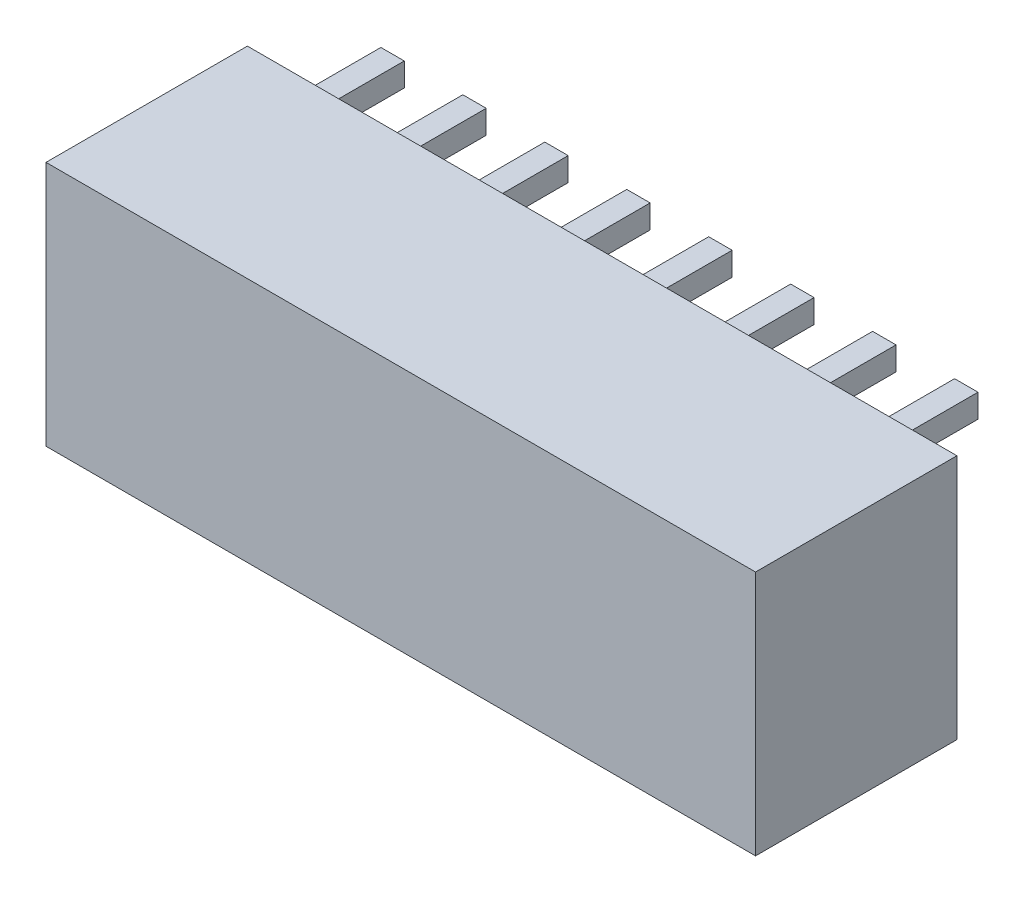
from build123d import *

# Parameters (mm, degrees)
SKETCH_1_W                         = 30.3
SKETCH_1_H                         = 10.5
EXTRUDE_1_DEPTH                    = 8.6
CUT_EXTRUDE_1_DEPTH                = 7
EXTRUDE_START                      = -5
SKETCH_3_W                         = 1
SKETCH_3_H                         = 1
EXTRUDE_2_DEPTH                    = 8.6
CHAMFER_1_SIZE                     = 0.3
PATTERN_LINEAR_1_COUNT             = 8
PATTERN_LINEAR_1_PITCH             = 3.5
CHAMFER_1_OF_PATTERN_LINEAR_1_SIZE = 0.3


with BuildPart() as part:
    # Эскиз1 → Бобышка-Вытянуть1 (new body)
    with BuildSketch(Plane.XY):
        Rectangle(SKETCH_1_W, SKETCH_1_H)
    extrude(amount=EXTRUDE_1_DEPTH)

    # Эскиз2 → Вырез-Вытянуть1 (cut)
    with BuildSketch(Plane.XZ.offset(5.25)):
        Polygon((-14.15, 6.6), (14.15, 6.6), (14.15, 0.2), (11.95, 0.2), (11.95, 1.8), (-10.35, 1.8), (-10.35, 0.2), (-12.55, 0.2), (-12.55, 1.8), (-14.15, 1.8), align=None)
    extrude(amount=-CUT_EXTRUDE_1_DEPTH, mode=Mode.SUBTRACT)

    # Эскиз3 → Бобышка-Вытянуть2 (add)
    with BuildSketch(Plane(origin=(0, 0, 0), x_dir=(-1, 0, 0), z_dir=(0, 0, -1)).offset(EXTRUDE_START)):
        with Locations((12.25, 4.25)):
            Rectangle(SKETCH_3_W, SKETCH_3_H)
    extrude_2 = extrude(amount=EXTRUDE_2_DEPTH)

    # Фаска1
    chamfer_1_edges = [part.edges().sort_by_distance(p)[0] for p in [
        (-11.75, 4.25, -3.6),
        (-12.25, 3.75, -3.6),
        (-12.75, 4.25, -3.6),
        (-12.25, 4.75, -3.6),
    ]]
    chamfer(chamfer_1_edges, length=CHAMFER_1_SIZE)

    # Линейный массив1: Бобышка-Вытянуть2 ×8
    with Locations(*[(i * PATTERN_LINEAR_1_PITCH, 0, 0) for i in range(1, PATTERN_LINEAR_1_COUNT)]):
        add(extrude_2)

    # Фаска1 of Линейный массив1
    chamfer_1_of_pattern_linear_1_edges = [part.edges().sort_by_distance(p)[0] for p in [
        (-8.25, 4.25, -3.6),
        (-8.75, 3.75, -3.6),
        (-9.25, 4.25, -3.6),
        (-8.75, 4.75, -3.6),
        (-4.75, 4.25, -3.6),
        (-5.25, 3.75, -3.6),
        (-5.75, 4.25, -3.6),
        (-5.25, 4.75, -3.6),
        (-1.25, 4.25, -3.6),
        (-1.75, 3.75, -3.6),
        (-2.25, 4.25, -3.6),
        (-1.75, 4.75, -3.6),
        (2.25, 4.25, -3.6),
        (1.75, 3.75, -3.6),
        (1.25, 4.25, -3.6),
        (1.75, 4.75, -3.6),
        (5.75, 4.25, -3.6),
        (5.25, 3.75, -3.6),
        (4.75, 4.25, -3.6),
        (5.25, 4.75, -3.6),
        (9.25, 4.25, -3.6),
        (8.75, 3.75, -3.6),
        (8.25, 4.25, -3.6),
        (8.75, 4.75, -3.6),
        (12.75, 4.25, -3.6),
        (12.25, 3.75, -3.6),
        (11.75, 4.25, -3.6),
        (12.25, 4.75, -3.6),
    ]]
    chamfer(chamfer_1_of_pattern_linear_1_edges, length=CHAMFER_1_OF_PATTERN_LINEAR_1_SIZE)


solid = part.part
